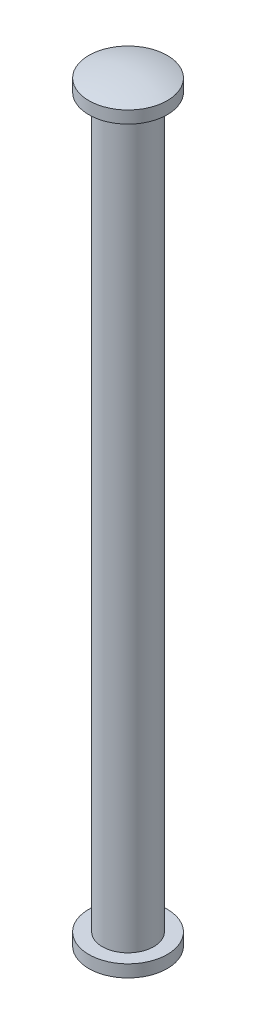
from build123d import *


with BuildPart() as part:
    # Sketch1 → Revolve1 (revolve)
    with BuildSketch(Plane.XY, mode=Mode.PRIVATE) as revolve1_sk:
        with BuildLine():
            Line((0, -19.812), (0, 19.812))
            ThreePointArc((0, 19.812), (1.029625208, 19.727969353), (2.032, 19.478101395))
            Line((2.032, 19.478101395), (2.032, 18.843101395))
            Line((2.032, 18.843101395), (1.3335, 18.843101395))
            Line((1.3335, 18.843101395), (1.3335, -18.843101395))
            Line((1.3335, -18.843101395), (2.032, -18.843101395))
            Line((2.032, -18.843101395), (2.032, -19.478101395))
            ThreePointArc((2.032, -19.478101395), (1.029625208, -19.727969353), (0, -19.812))
        make_face()
    revolve(revolve1_sk.sketch.rotate(Axis((0, -19.812, 0), (0, 1, 0)), 90), axis=Axis((0, -19.812, 0), (0, 1, 0)))


solid = part.part
